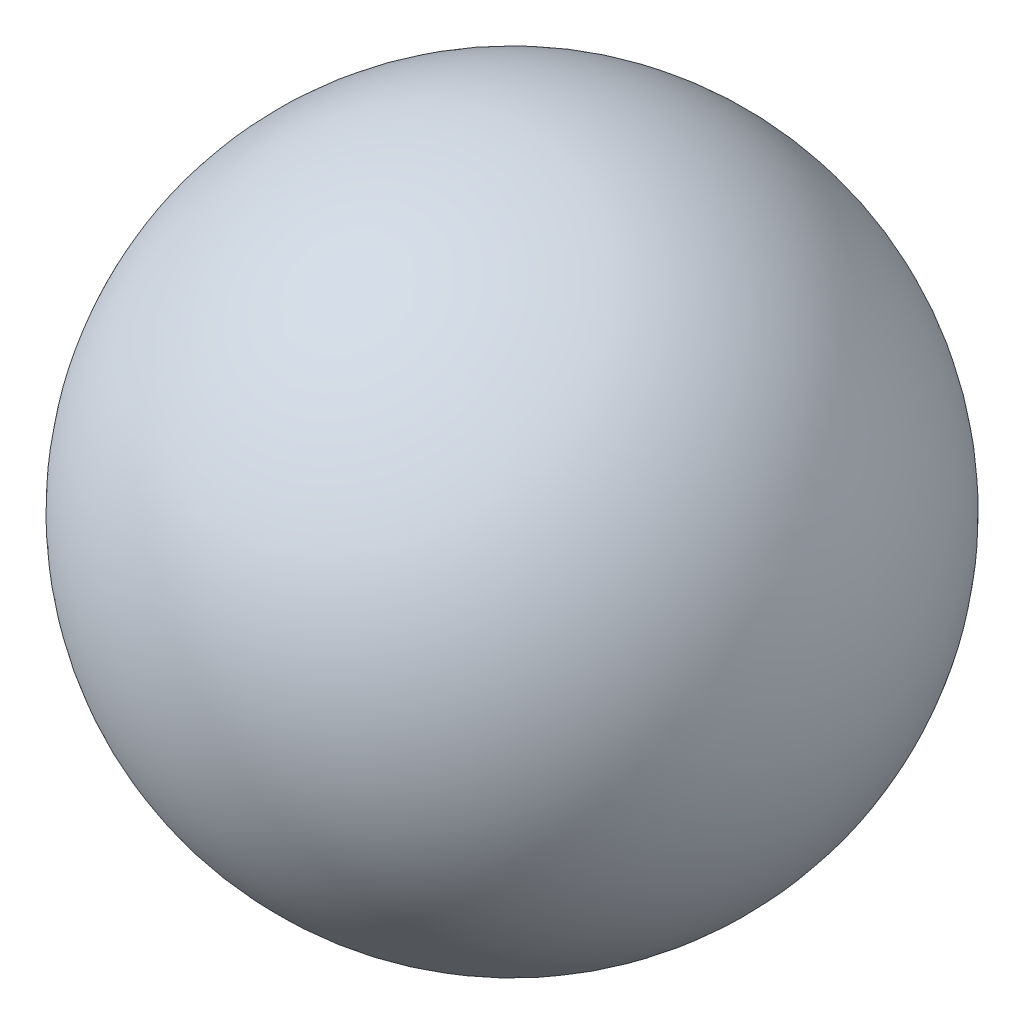
from build123d import *


with BuildPart() as part:
    # Sketch1 → Revolve1 (revolve)
    with BuildSketch(Plane.XY):
        with BuildLine():
            Line((3.209989756, 0), (4.727510244, 0))
            ThreePointArc((4.727510244, 0), (3.96875, 0.758760244), (3.209989756, 0))
        make_face()
    revolve(axis=Axis((3.209989756, 0, 0), (1, 0, 0)))


solid = part.part
